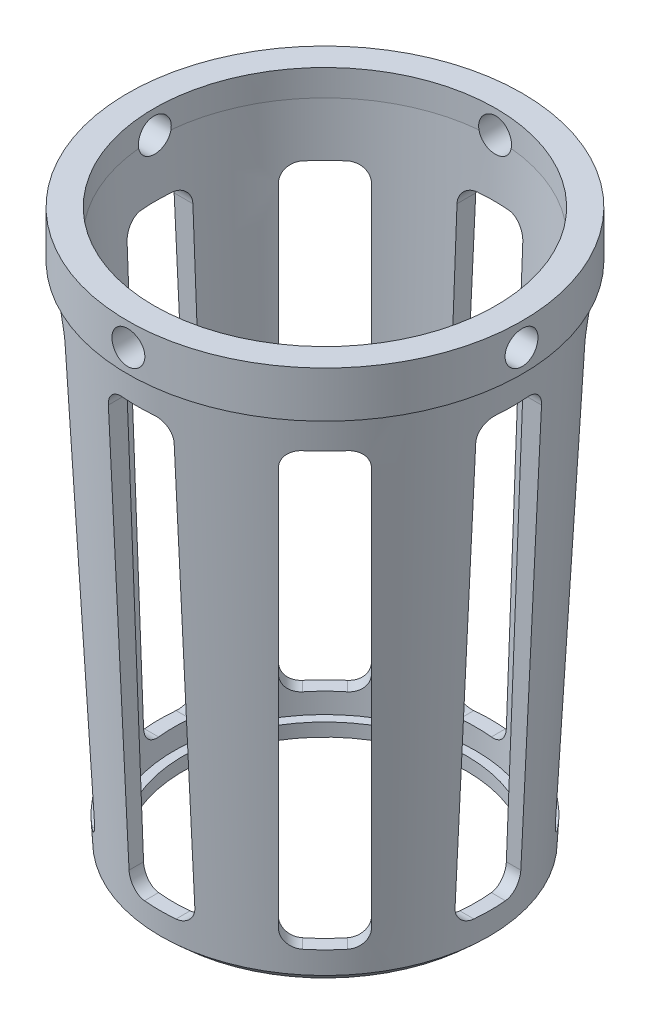
from build123d import *

# Parameters (mm, degrees)
CUT_EXTRUDE2_DEPTH = 45.212
CIRPATTERN2_COUNT  = 4
CUT_EXTRUDE3_DEPTH = 124.206
CIRPATTERN3_COUNT  = 8
CHAMFER1_SIZE      = 2.006067388
CHAMFER1_SIZE2     = 1.905
FILLET1_R          = 3.302
FILLET2_R          = 3.302


with BuildPart() as part:
    # Sketch2 → Revolve2 (revolve)
    with BuildSketch(Plane.XY, mode=Mode.PRIVATE) as revolve2_sk:
        Polygon((27.3304, 2.54), (27.3304, 0), (31.623, 0), (36.4998, 99.06), (38.0746, 99.06), (38.0746, 107.95), (32.9946, 107.95), (32.9946, 102.87), (29.083, 2.54), align=None)
    revolve(revolve2_sk.sketch.rotate(Axis((0, 0, 0), (0, 1, 0)), 90), axis=Axis((0, 0, 0), (0, 1, 0)))

    # Sketch5 → Cut-Extrude2 (cut)
    with BuildSketch(Plane.XY):
        with BuildLine():
            ThreePointArc((3.175, 103.505), (2.24506403, 105.75006403), (0, 106.68))
            Line((0, 106.68), (0, 100.33))
            ThreePointArc((0, 100.33), (2.24506403, 101.25993597), (3.175, 103.505))
        make_face()
        with BuildLine():
            Line((0, 100.33), (0, 106.68))
            ThreePointArc((0, 106.68), (-3.175, 103.505), (0, 100.33))
        make_face()
    cut_extrude2 = extrude(amount=-CUT_EXTRUDE2_DEPTH, mode=Mode.SUBTRACT)

    # CirPattern2: Cut-Extrude2 ×4 about axis
    cirpattern2_axis = Axis((0, 0, 0), (0, -1, 0))
    for i in range(1, CIRPATTERN2_COUNT):
        add(cut_extrude2.rotate(cirpattern2_axis, i * 360 / CIRPATTERN2_COUNT), mode=Mode.SUBTRACT)

    # Sketch6 → Cut-Extrude3 (cut)
    with BuildSketch(Plane(origin=(0, 0, 0), x_dir=(0, 0, -1), z_dir=(1, 0, 0))):
        Polygon((0, 92.71), (-6.35, 92.71), (-6.35, 6.35), (6.35, 6.35), (6.35, 92.71), align=None)
    cut_extrude3 = extrude(amount=-CUT_EXTRUDE3_DEPTH, mode=Mode.SUBTRACT)

    # CirPattern3: Cut-Extrude3 ×8 about axis
    cirpattern3_axis = Axis((0, 0, 0), (0, 1, 0))
    for i in range(1, CIRPATTERN3_COUNT):
        add(cut_extrude3.rotate(cirpattern3_axis, i * 360 / CIRPATTERN3_COUNT), mode=Mode.SUBTRACT)

    # Chamfer1
    chamfer1_edges = [part.edges().sort_by_distance(p)[0] for p in [
        (0, 0, 31.623),
    ]]
    chamfer1_side = [part.faces().sort_by_distance(p)[0] for p in [
        (0, 0, 28.22483351),
    ]]
    chamfer(chamfer1_edges, length=CHAMFER1_SIZE, length2=CHAMFER1_SIZE2, reference=chamfer1_side[0])

    # Fillet1
    fillet1_edges = [part.edges().sort_by_distance(p)[0] for p in [
        (-25.643735889, 6.35, 16.663479768),
        (-6.35, 6.35, 29.915719084),
        (16.663479768, 6.35, 25.643735889),
        (29.915719084, 6.35, 6.35),
        (25.643735889, 6.35, -16.663479768),
        (6.35, 6.35, -29.915719084),
        (-16.663479768, 6.35, 25.643735889),
        (-16.663479768, 6.35, -25.643735889),
        (-25.643735889, 6.35, -16.663479768),
        (16.663479768, 6.35, -25.643735889),
        (25.643735889, 6.35, 16.663479768),
        (6.35, 6.35, 29.915719084),
        (29.915719084, 6.35, -6.35),
        (-6.35, 6.35, -29.915719084),
        (-29.915719084, 6.35, -6.35),
        (-29.915719084, 6.35, 6.35),
    ]]
    fillet(fillet1_edges, radius=FILLET1_R)

    # Fillet2
    fillet2_edges = [part.edges().sort_by_distance(p)[0] for p in [
        (19.409984377, 92.71, -28.390240498),
        (33.799863152, 92.71, -6.35),
        (28.390240498, 92.71, 19.409984377),
        (6.35, 92.71, 33.799863152),
        (-19.409984377, 92.71, 28.390240498),
        (-28.390240498, 92.71, -19.409984377),
        (-28.390240498, 92.71, 19.409984377),
        (-6.35, 92.71, -33.799863152),
        (-6.35, 92.71, 33.799863152),
        (19.409984377, 92.71, 28.390240498),
        (33.799863152, 92.71, 6.35),
        (28.390240498, 92.71, -19.409984377),
        (6.35, 92.71, -33.799863152),
        (-19.409984377, 92.71, -28.390240498),
        (-33.799863152, 92.71, 6.35),
        (-33.799863152, 92.71, -6.35),
    ]]
    fillet(fillet2_edges, radius=FILLET2_R)


solid = part.part
